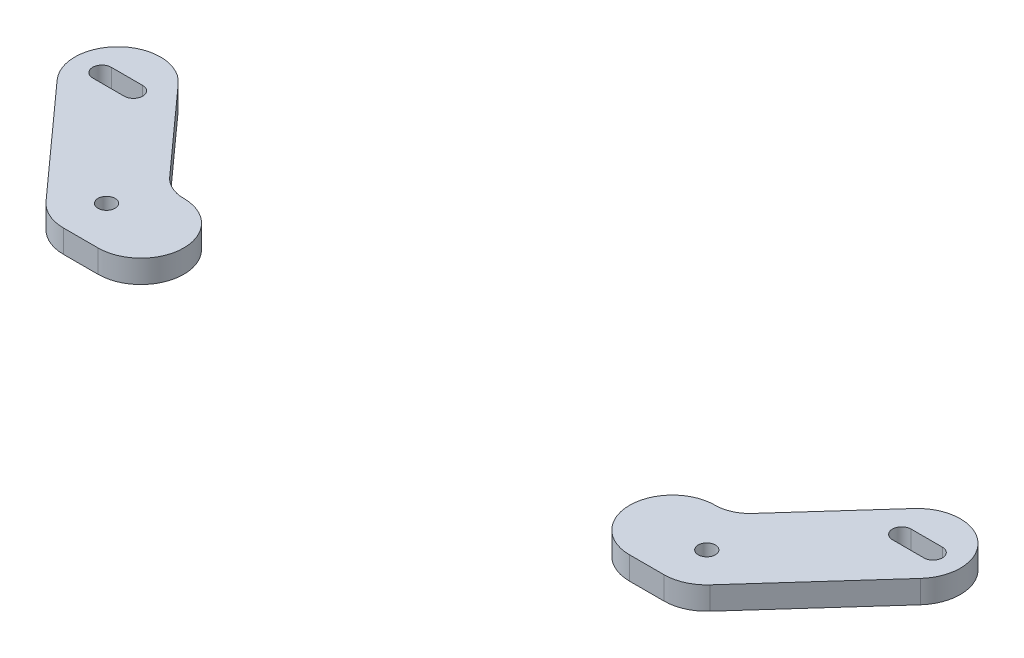
from build123d import *

# Parameters (mm, degrees)
SKETCH1_R           = 3
BOSS_EXTRUDE1_DEPTH = 8
CUT_EXTRUDE1_DEPTH  = 220.561312621


with BuildPart() as part:
    # Sketch1 → Boss-Extrude1 (new body)
    with BuildSketch(Plane(origin=(0, 0, 0), x_dir=(1, 0, 0), z_dir=(0, 1, 0))):
        with BuildLine():
            Line((-128.747729842, 150.431294549), (-101.892422534, 120.574964361))
            ThreePointArc((-101.892422534, 120.574964361), (-97.854230693, 117.638694702), (-92.970606408, 116.6))
            Line((-92.970606408, 116.6), (92.970606408, 116.6))
            ThreePointArc((92.970606408, 116.6), (97.854230693, 117.638694702), (101.892422534, 120.574964361))
            Line((101.892422534, 120.574964361), (128.747729842, 150.431294549))
            ThreePointArc((128.747729842, 150.431294549), (149.931294549, 151.552270158), (151.052270158, 130.368705451))
            Line((151.052270158, 130.368705451), (116.152270158, 91.568705451))
            ThreePointArc((116.152270158, 91.568705451), (111.104530357, 87.898368378), (105, 86.6))
            Line((105, 86.6), (-105, 86.6))
            ThreePointArc((-105, 86.6), (-111.104530357, 87.898368378), (-116.152270158, 91.568705451))
            Line((-116.152270158, 91.568705451), (-151.052270158, 130.368705451))
            ThreePointArc((-151.052270158, 130.368705451), (-149.931294549, 151.552270158), (-128.747729842, 150.431294549))
        make_face()
        with Locations(Location((-105, 101.6, 0), (0, 0, 270))):
            Circle(SKETCH1_R, mode=Mode.SUBTRACT)
        with Locations(Location((105, 101.6, 0), (0, 0, 270))):
            Circle(SKETCH1_R, mode=Mode.SUBTRACT)
        with BuildLine():
            Line((-145.4, 143.65), (-134.4, 143.65))
            ThreePointArc((-134.4, 143.65), (-131.15, 140.4), (-134.4, 137.15))
            Line((-134.4, 137.15), (-145.4, 137.15))
            ThreePointArc((-145.4, 137.15), (-148.65, 140.4), (-145.4, 143.65))
        make_face(mode=Mode.SUBTRACT)
        with BuildLine():
            Line((145.4, 137.15), (134.4, 137.15))
            ThreePointArc((134.4, 137.15), (131.15, 140.4), (134.4, 143.65))
            Line((134.4, 143.65), (145.4, 143.65))
            ThreePointArc((145.4, 143.65), (148.65, 140.4), (145.4, 137.15))
        make_face(mode=Mode.SUBTRACT)
    extrude(amount=BOSS_EXTRUDE1_DEPTH)

    # Sketch3 → Cut-Extrude1 (cut, through all)
    with BuildSketch(Plane(origin=(0, 8, 0), x_dir=(1, 0, 0), z_dir=(0, 1, 0))):
        with BuildLine():
            Line((-92.970606408, 116.6), (92.970606408, 116.6))
            ThreePointArc((92.970606408, 116.6), (77.970606408, 101.6), (92.970606408, 86.6))
            Line((92.970606408, 86.6), (-92.970606408, 86.6))
            ThreePointArc((-92.970606408, 86.6), (-77.970606408, 101.6), (-92.970606408, 116.6))
        make_face()
    extrude(amount=-CUT_EXTRUDE1_DEPTH, mode=Mode.SUBTRACT)


with BuildPart() as cut_extrude1_piece_1:
    # of the separate pieces the step leaves, piece 1, a body of its own (cut_extrude1_pieces)
    add(part.part.solids().sort_by_distance((92.970606408, 0, -116.6))[0])


with BuildPart() as cut_extrude1_piece_2:
    # of the separate pieces the step leaves, piece 2, a body of its own (cut_extrude1_pieces)
    add(part.part.solids().sort_by_distance((-128.747729842, 0, -150.431294549))[0])


solid = Compound([cut_extrude1_piece_1.part, cut_extrude1_piece_2.part])
